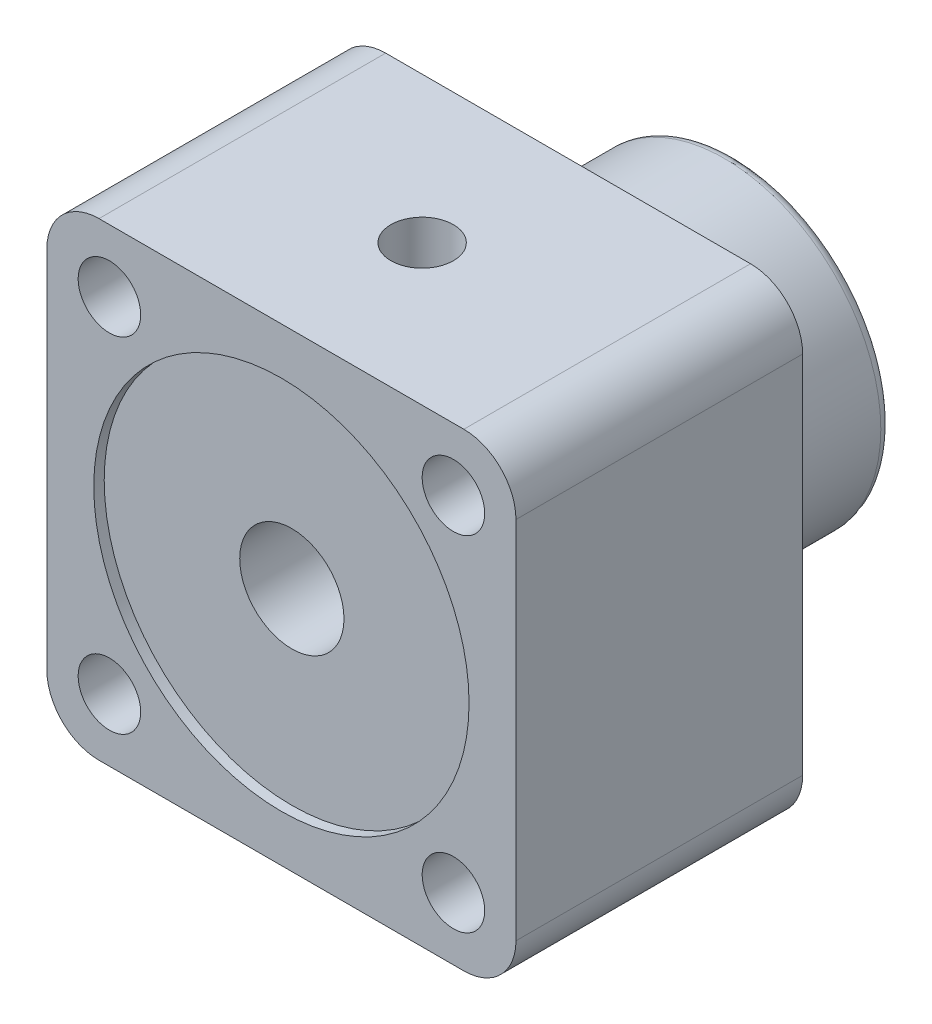
from build123d import *

# Parameters (mm, degrees)
SKETCH1_R               = 3
BOSS_EXTRUDE1_DEPTH     = 27.5
SKETCH3_R               = 18
CUT_EXTRUDE1_DEPTH      = 1
SKETCH4_R               = 5
CUT_EXTRUDE2_DEPTH      = 70.327123119
BOSS_EXTRUDE2_START     = 16
SKETCH5_R               = 15
SKETCH5_R_2             = 5
BOSS_EXTRUDE2_DEPTH     = 16
FILLET1_R               = 1
CUT_EXTRUDE3_REACH      = 71.327
CUT_EXTRUDE3_END_RADIUS = 5
SKETCH6_R               = 3


with BuildPart() as part:
    # Sketch1 → Boss-Extrude1 (new body)
    with BuildSketch(Plane.XY):
        with BuildLine():
            Line((0, 40), (0, 5))
            ThreePointArc((0, 5), (-1.464466094, 1.464466094), (-5, 0))
            Line((-5, 0), (-40, 0))
            ThreePointArc((-40, 0), (-43.535533906, 1.464466094), (-45, 5))
            Line((-45, 5), (-45, 40))
            ThreePointArc((-45, 40), (-43.535533906, 43.535533906), (-40, 45))
            Line((-40, 45), (-5, 45))
            ThreePointArc((-5, 45), (-1.464466094, 43.535533906), (0, 40))
        make_face()
        with Locations((-6, 39)):
            Circle(SKETCH1_R, mode=Mode.SUBTRACT)
        with Locations((-6, 6)):
            Circle(SKETCH1_R, mode=Mode.SUBTRACT)
        with Locations(Location((-39, 6, 0), (0, 0, 180))):
            Circle(SKETCH1_R, mode=Mode.SUBTRACT)
        with Locations(Location((-39, 39, 0), (0, 0, 180))):
            Circle(SKETCH1_R, mode=Mode.SUBTRACT)
    extrude(amount=BOSS_EXTRUDE1_DEPTH)

    # Sketch3 → Cut-Extrude1 (cut)
    with BuildSketch(Plane.XY.offset(27.5)):
        with Locations((-22.5, 22.5)):
            Circle(SKETCH3_R)
    extrude(amount=-CUT_EXTRUDE1_DEPTH, mode=Mode.SUBTRACT)

    # Sketch4 → Cut-Extrude2 (cut, through all)
    with BuildSketch(Plane(origin=(0, 0, 0), x_dir=(-1, 0, 0), z_dir=(0, 0, -1))):
        with Locations((22.5, 22.5)):
            Circle(SKETCH4_R)
    extrude(amount=-CUT_EXTRUDE2_DEPTH, mode=Mode.SUBTRACT)

    # Sketch5 → Boss-Extrude2 (add)
    with BuildSketch(Plane(origin=(0, 0, 0), x_dir=(-1, 0, 0), z_dir=(0, 0, -1)).offset(BOSS_EXTRUDE2_START)):
        with Locations(Location((22.5, 22.5, 0), (0, 0, 180))):
            Circle(SKETCH5_R)
        with Locations((22.5, 22.5)):
            Circle(SKETCH5_R_2, mode=Mode.SUBTRACT)
    extrude(amount=-BOSS_EXTRUDE2_DEPTH)

    # Fillet1
    fillet1_edges = [part.edges().sort_by_distance(p)[0] for p in [
        (-37.5, 22.5, -16),
    ]]
    fillet(fillet1_edges, radius=FILLET1_R)

    # Cut-Extrude3: up to this cylinder (the profile starts outside it)
    cut_extrude3_end = Plane(origin=(-22.5, 22.5, 14), z_dir=(0, 0, -1)) * Cylinder(CUT_EXTRUDE3_END_RADIUS, 153.654, mode=Mode.PRIVATE)
    # Sketch6 → Cut-Extrude3 (cut, up to the surface)
    with BuildSketch(Plane(origin=(0, 45, 0), x_dir=(1, 0, 0), z_dir=(0, 1, 0)), mode=Mode.PRIVATE) as cut_extrude3_sk1:
        with Locations(Location((-22.5, -14, 0), (0, 0, 180))):
            Circle(SKETCH6_R)
    cut_extrude3_tool1 = extrude(cut_extrude3_sk1.sketch, amount=-CUT_EXTRUDE3_REACH, mode=Mode.PRIVATE) - cut_extrude3_end
    add(cut_extrude3_tool1.solids().sort_by_distance((-22.5, 45, 14))[0], mode=Mode.SUBTRACT)


solid = part.part
